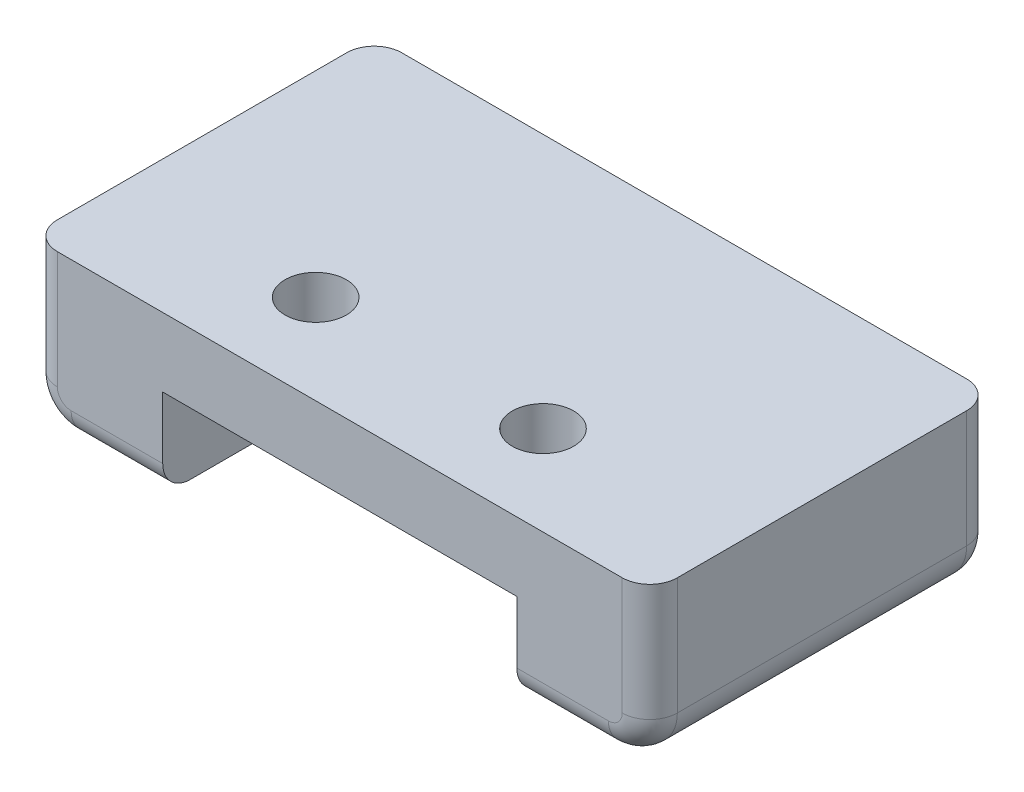
from build123d import *

# Parameters (mm, degrees)
BOSS_EXTRUDE1_DEPTH = 25
SKETCH2_R           = 2.225
CUT_EXTRUDE1_DEPTH  = 36.545745174
FILLET1_R           = 3
FILLET2_R           = 2


with BuildPart() as part:
    # Sketch1 → Boss-Extrude1 (new body)
    with BuildSketch(Plane.XY):
        Polygon((-22.5, 5), (22.5, 5), (22.5, -6.5), (12.85, -6.5), (12.85, 0), (-12.85, 0), (-12.85, -6.5), (-22.5, -6.5), align=None)
    extrude(amount=BOSS_EXTRUDE1_DEPTH)

    # Sketch2 → Cut-Extrude1 (cut, through all)
    with BuildSketch(Plane(origin=(0, 5, 0), x_dir=(1, 0, 0), z_dir=(0, 1, 0))):
        with Locations((-8.25, -18.5)):
            Circle(SKETCH2_R)
        with Locations((8.25, -18.5)):
            Circle(SKETCH2_R)
    extrude(amount=-CUT_EXTRUDE1_DEPTH, mode=Mode.SUBTRACT)

    # Fillet1
    fillet1_edges = [part.edges().sort_by_distance(p)[0] for p in [
        (22.5, -6.5, 12.5),
        (-22.5, -6.5, 12.5),
    ]]
    fillet(fillet1_edges, radius=FILLET1_R)

    # Fillet2
    fillet2_edges = [part.edges().sort_by_distance(p)[0] for p in [
        (16.175, -6.5, 25),
        (21.621320344, -5.621320344, 25),
        (-16.175, -6.5, 25),
        (-21.621320344, -5.621320344, 25),
        (-16.175, -6.5, 0),
        (-21.621320344, -5.621320344, 0),
        (16.175, -6.5, 0),
        (21.621320344, -5.621320344, 0),
        (22.5, 0.75, 25),
        (-22.5, 0.75, 25),
        (-22.5, 0.75, 0),
        (22.5, 0.75, 0),
    ]]
    fillet(fillet2_edges, radius=FILLET2_R)


solid = part.part
